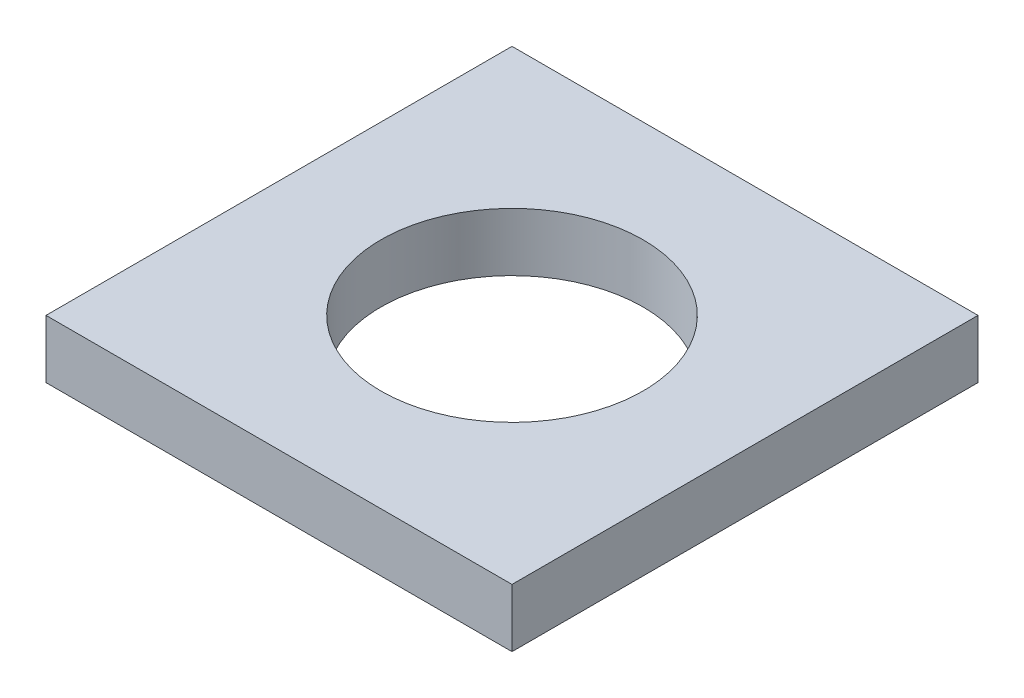
from build123d import *

# Parameters (mm, degrees)
CROQUIS1_W              = 101.6
CROQUIS1_H              = 101.6
SALIENTE_EXTRUIR1_DEPTH = 12.7
CROQUIS2_R              = 28.575
CORTAR_EXTRUIR1_DEPTH   = 12.7


with BuildPart() as part:
    # Croquis1 → Saliente-Extruir1 (new body)
    with BuildSketch(Plane(origin=(0, 0, 0), x_dir=(1, 0, 0), z_dir=(0, 1, 0))):
        with Locations((50.8, 50.8)):
            Rectangle(CROQUIS1_W, CROQUIS1_H)
    extrude(amount=SALIENTE_EXTRUIR1_DEPTH)

    # Croquis2 → Cortar-Extruir1 (cut)
    with BuildSketch(Plane.XZ):
        with Locations(Location((50.8, -50.8, 0), (0, 0, 270))):
            Circle(CROQUIS2_R)
    extrude(amount=-CORTAR_EXTRUIR1_DEPTH, mode=Mode.SUBTRACT)


solid = part.part
